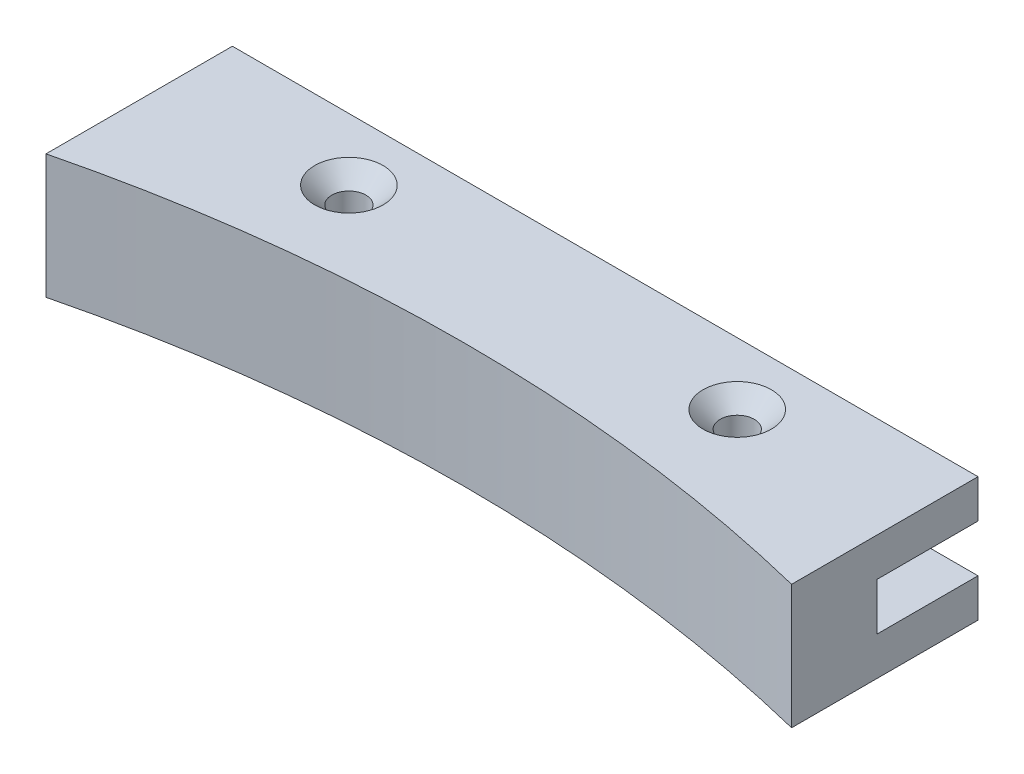
from build123d import *

# Parameters (mm, degrees)
BOSS_EXTRUDE1_DEPTH                             = 4
CSK_FOR_M2_FLAT_HEAD_MACHINE_SCREW1_D           = 2.2
CSK_FOR_M2_FLAT_HEAD_MACHINE_SCREW1_CSINK_D     = 4.4
CSK_FOR_M2_FLAT_HEAD_MACHINE_SCREW1_CSINK_ANGLE = 90
SKETCH9_W                                       = 6.5
SKETCH9_H                                       = 3.05
CUT_EXTRUDE2_DEPTH                              = 50.638694584


with BuildPart() as part:
    # Sketch1 → Boss-Extrude1 (new, symmetric)
    with BuildSketch(Plane(origin=(0, 0, 0), x_dir=(1, 0, 0), z_dir=(0, 1, 0))):
        with BuildLine():
            Line((-24, 0), (24, 0))
            Line((24, 0), (24, -12))
            ThreePointArc((24, -12), (0, -9.077288796), (-24, -12))
            Line((-24, -12), (-24, 0))
        make_face()
    extrude(amount=BOSS_EXTRUDE1_DEPTH, both=True)

    # CSK for M2 Flat Head Machine Screw1 (through all)
    with Locations(Plane(origin=(0, 4, 0), x_dir=(1, 0, 0), z_dir=(0, 1, 0))):
        with Locations((12.5, -4), (-12.5, -4)):
            CounterSinkHole(CSK_FOR_M2_FLAT_HEAD_MACHINE_SCREW1_D / 2, CSK_FOR_M2_FLAT_HEAD_MACHINE_SCREW1_CSINK_D / 2, counter_sink_angle=CSK_FOR_M2_FLAT_HEAD_MACHINE_SCREW1_CSINK_ANGLE)

    # Sketch9 → Cut-Extrude2 (cut, through all)
    with BuildSketch(Plane.ZY.offset(24)):
        with Locations((3.25, 0)):
            Rectangle(SKETCH9_W, SKETCH9_H)
    extrude(amount=-CUT_EXTRUDE2_DEPTH, mode=Mode.SUBTRACT)


solid = part.part
